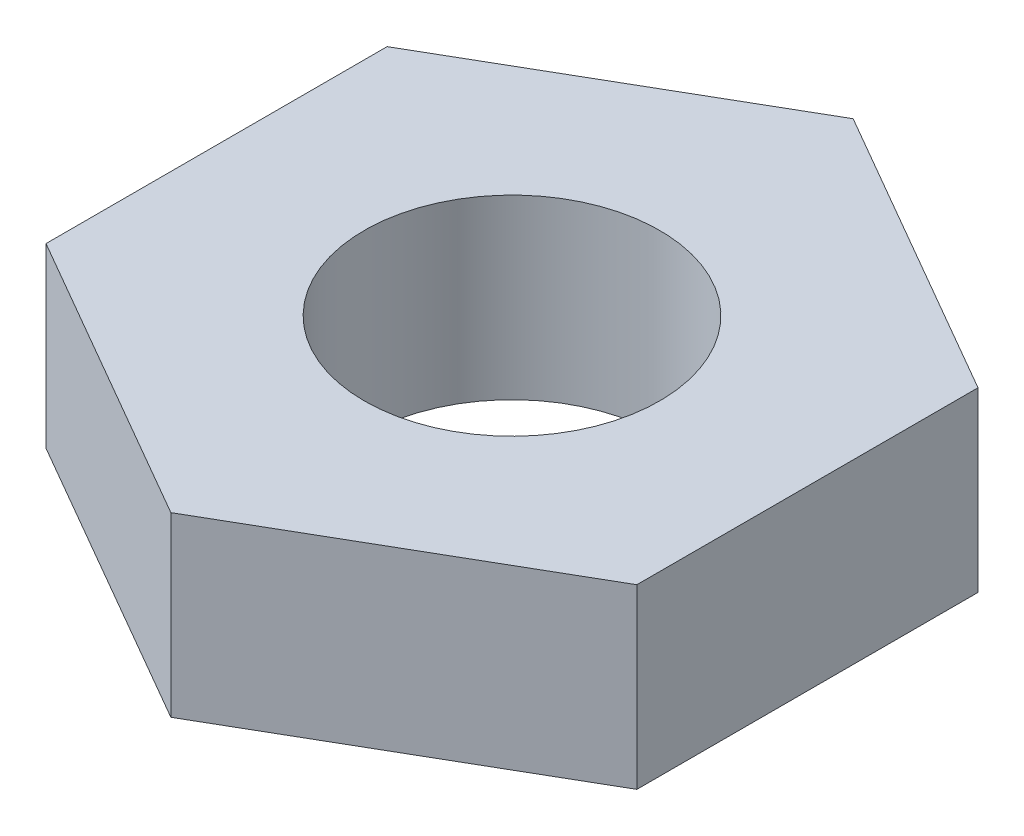
from build123d import *

# Parameters (mm, degrees)
SKETCH_1_R      = 1
EXTRUDE_1_DEPTH = 1.2


with BuildPart() as part:
    # 草图1 → 凸台-拉伸1 (new body)
    with BuildSketch(Plane(origin=(0, 0, 0), x_dir=(1, 0, 0), z_dir=(0, 1, 0))):
        Polygon((0, 2.309401077), (-2, 1.154700538), (-2, -1.154700538), (0, -2.309401077), (2, -1.154700538), (2, 1.154700538), align=None)
        with Locations(Location((0, 0, 0), (0, 0, 270))):
            Circle(SKETCH_1_R, mode=Mode.SUBTRACT)
    extrude(amount=EXTRUDE_1_DEPTH)


solid = part.part
